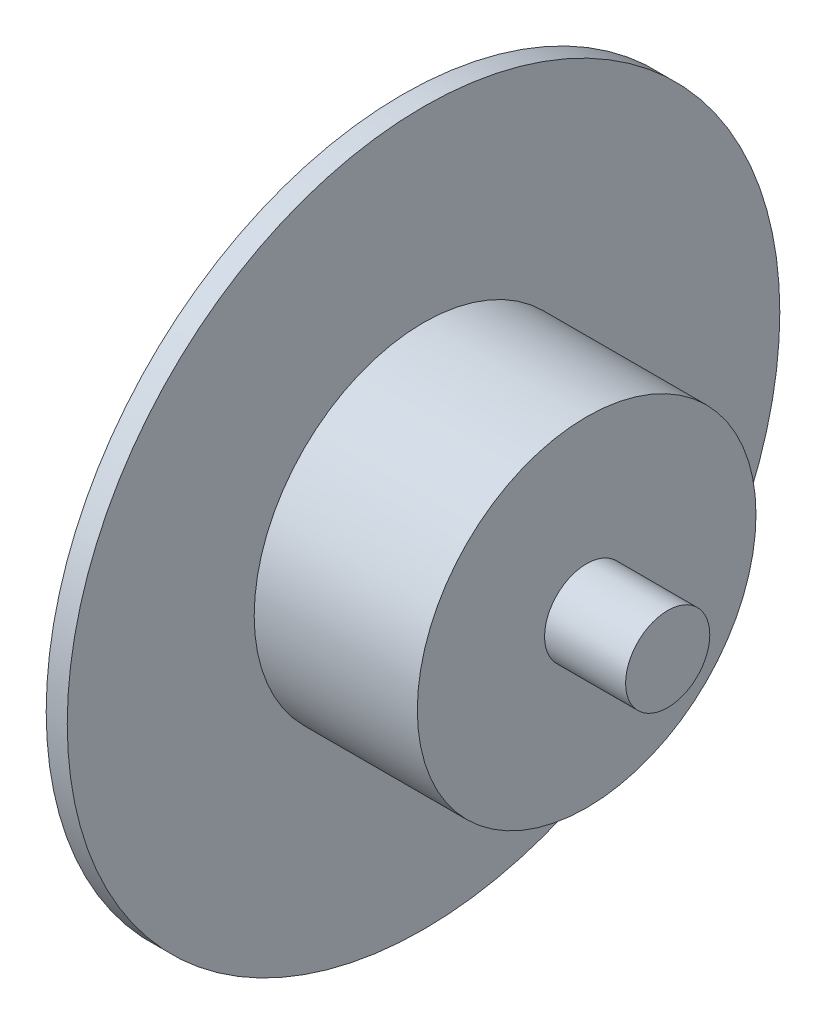
from build123d import *

# Parameters (mm, degrees)
SKETCH1_R               = 50
BOSS_EXTRUDE1_DEPTH     = 140
SKETCH2_W               = 10
SKETCH2_H               = 60
BOSS_EXTRUDE2_START     = 100
SKETCH3_R               = 50
BOSS_EXTRUDE2_DEPTH     = 100
SKETCH4_R               = 169.268161275
BOSS_EXTRUDE3_DEPTH     = 10
FILLET2_R               = 50
CUT_EXTRUDE1_DEPTH      = 278.314660346
CUT_EXTRUDE1_DEPTH_BACK = 278.314660346
SKETCH5_W               = 561.706839888
SKETCH5_H               = 604.768431274
SKETCH6_R               = 20
BOSS_EXTRUDE4_DEPTH     = 116
SKETCH7_W               = 77.5
SKETCH7_H               = 80.450571877


with BuildPart() as part:
    # Sketch1 → Boss-Extrude1 (new body)
    with BuildSketch(Plane(origin=(0, 0, 0), x_dir=(0, 0, -1), z_dir=(1, 0, 0))):
        Circle(SKETCH1_R)
    extrude(amount=BOSS_EXTRUDE1_DEPTH)

    # Sketch2 → Revolve1 (revolve)
    with BuildSketch(Plane(origin=(0, 0, 0), x_dir=(1, 0, 0), z_dir=(0, 1, 0)), mode=Mode.PRIVATE) as revolve1_sk:
        with Locations((15, 30)):
            Rectangle(SKETCH2_W, SKETCH2_H)
        with Locations((125, 30)):
            Rectangle(SKETCH2_W, SKETCH2_H)
    revolve(revolve1_sk.sketch.rotate(Axis((0, 0, 0), (1, 0, 0)), 180), axis=Axis((0, 0, 0), (1, 0, 0)))

    # Sketch3 → Boss-Extrude2 (add)
    with BuildSketch(Plane.ZY.offset(BOSS_EXTRUDE2_START)):
        Circle(SKETCH3_R)
    extrude(amount=-BOSS_EXTRUDE2_DEPTH)

    # Sketch4 → Boss-Extrude3 (add)
    with BuildSketch(Plane.ZY.offset(100)):
        Circle(SKETCH4_R)
    extrude(amount=BOSS_EXTRUDE3_DEPTH)

    # Fillet2
    fillet2_edges = [part.edges().sort_by_distance(p)[0] for p in [
        (-100, 0, -50),
    ]]
    fillet(fillet2_edges, radius=FILLET2_R)

    # Sketch5 → Cut-Extrude1 (cut, two sides: drawn at the far end of the back side and taken through both)
    with BuildSketch(Plane(origin=(0, 0, 0), x_dir=(1, 0, 0), z_dir=(0, 1, 0)).offset(-CUT_EXTRUDE1_DEPTH_BACK)):
        with Locations((180.853419944, 0)):
            Rectangle(SKETCH5_W, SKETCH5_H)
    extrude(amount=CUT_EXTRUDE1_DEPTH + CUT_EXTRUDE1_DEPTH_BACK, mode=Mode.SUBTRACT)

    # Sketch6 → Boss-Extrude4 (add)
    with BuildSketch(Plane(origin=(-100, 0, 0), x_dir=(0, 0, -1), z_dir=(1, 0, 0))):
        with Locations(Location((0, 0, 0), (0, 0, 180))):
            Circle(SKETCH6_R)
    extrude(amount=BOSS_EXTRUDE4_DEPTH)

    # Sketch7 → Revolve2 (revolve)
    with BuildSketch(Plane(origin=(0, 0, 0), x_dir=(1, 0, 0), z_dir=(0, 1, 0)), mode=Mode.PRIVATE) as revolve2_sk:
        with Locations((-61.25, 40.225285939)):
            Rectangle(SKETCH7_W, SKETCH7_H)
    revolve(revolve2_sk.sketch.rotate(Axis((-151.154136958, 0, 0), (1, 0, 0)), 180), axis=Axis((-151.154136958, 0, 0), (1, 0, 0)))


solid = part.part
